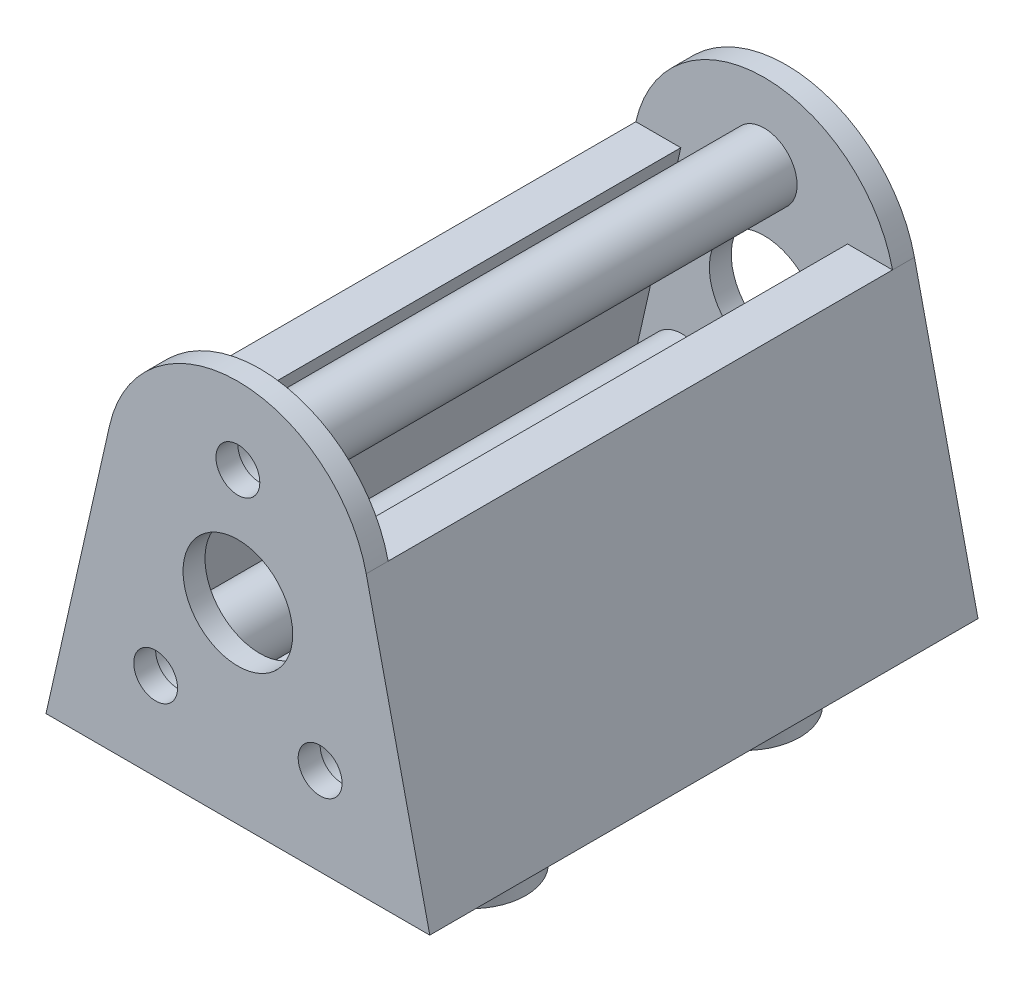
from build123d import *

# Parameters (mm, degrees)
SKETCH1_R           = 5
SKETCH1_R_2         = 2
BOSS_EXTRUDE1_DEPTH = 2
SKETCH2_R           = 2
SKETCH2_R_2         = 5
BOSS_EXTRUDE2_DEPTH = 2
SKETCH4_R           = 3
SKETCH4_R_2         = 2.5
BOSS_EXTRUDE4_DEPTH = 46
BOSS_EXTRUDE5_REACH = 63.929
SKETCH8_R           = 5
SKETCH8_R_2         = 2.5
BOSS_EXTRUDE6_DEPTH = 5


with BuildPart() as part:
    # Sketch1 → Boss-Extrude1 (new body)
    with BuildSketch(Plane.XY):
        with BuildLine():
            Line((-17.5, 0), (17.5, 0))
            Line((17.5, 0), (11.704867869, 25.645008161))
            ThreePointArc((11.704867869, 25.645008161), (0, 35), (-11.704867869, 25.645008161))
            Line((-11.704867869, 25.645008161), (-17.5, 0))
        make_face()
        with Locations((0, 17.5)):
            Circle(SKETCH1_R, mode=Mode.SUBTRACT)
        with Locations((7.5, 8)):
            Circle(SKETCH1_R_2, mode=Mode.SUBTRACT)
        with Locations((-7.5, 8)):
            Circle(SKETCH1_R_2, mode=Mode.SUBTRACT)
        with Locations((0, 28)):
            Circle(SKETCH1_R_2, mode=Mode.SUBTRACT)
    extrude(amount=BOSS_EXTRUDE1_DEPTH)



with BuildPart() as body_2:
    # Sketch2 → Boss-Extrude2 (new body)
    with BuildSketch(Plane.XY.offset(-48)):
        with BuildLine():
            Line((17.5, 0), (11.704867869, 25.645008161))
            ThreePointArc((11.704867869, 25.645008161), (0, 35), (-11.704867869, 25.645008161))
            Line((-11.704867869, 25.645008161), (-17.5, 0))
            Line((-17.5, 0), (17.5, 0))
        make_face()
        with Locations((-7.5, 8)):
            Circle(SKETCH2_R, mode=Mode.SUBTRACT)
        with Locations((7.5, 8)):
            Circle(SKETCH2_R, mode=Mode.SUBTRACT)
        with Locations((0, 17.5)):
            Circle(SKETCH2_R_2, mode=Mode.SUBTRACT)
        with Locations((0, 28)):
            Circle(SKETCH2_R, mode=Mode.SUBTRACT)
    extrude(amount=BOSS_EXTRUDE2_DEPTH)


with BuildPart() as part_1:
    add(part.part)

    add(body_2.part)  # Boss-Extrude4 merges body 2
    # Sketch4 → Boss-Extrude4 (add)
    # profile 1 of 3: a face of its own
    with BuildSketch(Plane(origin=(0, 0, 0), x_dir=(-1, 0, 0), z_dir=(0, 0, -1))):
        with Locations(Location((7.5, 8, 0), (0, 0, 180))):
            Circle(SKETCH4_R)
        with Locations(Location((7.5, 8, 0), (0, 0, 180))):
            Circle(SKETCH4_R_2, mode=Mode.SUBTRACT)
    # profile 2 of 3: a face of its own
    with BuildSketch(Plane(origin=(0, 0, 0), x_dir=(-1, 0, 0), z_dir=(0, 0, -1))):
        with Locations(Location((0, 28, 0), (0, 0, 180))):
            Circle(SKETCH4_R)
        with Locations(Location((0, 28, 0), (0, 0, 180))):
            Circle(SKETCH4_R_2, mode=Mode.SUBTRACT)
    # profile 3 of 3: a face of its own
    with BuildSketch(Plane(origin=(0, 0, 0), x_dir=(-1, 0, 0), z_dir=(0, 0, -1))):
        with Locations(Location((-7.5, 8, 0), (0, 0, 180))):
            Circle(SKETCH4_R)
        with Locations(Location((-7.5, 8, 0), (0, 0, 180))):
            Circle(SKETCH4_R_2, mode=Mode.SUBTRACT)
    extrude(amount=BOSS_EXTRUDE4_DEPTH)

    # Sketch3 → Boss-Extrude5 (add, up to next)
    with BuildSketch(Plane(origin=(0, 0, 0), x_dir=(-1, 0, 0), z_dir=(0, 0, -1)), mode=Mode.PRIVATE) as boss_extrude5_sk1:
        Polygon((12.495241869, 4), (16.59609978, 4), (11.704867869, 25.645008161), (7.604009958, 25.645008161), align=None)
    boss_extrude5_tool1 = extrude(boss_extrude5_sk1.sketch, amount=BOSS_EXTRUDE5_REACH, mode=Mode.PRIVATE) - part_1.part
    # Sketch3 → Boss-Extrude5 (add, up to next)
    with BuildSketch(Plane(origin=(0, 0, 0), x_dir=(-1, 0, 0), z_dir=(0, 0, -1)), mode=Mode.PRIVATE) as boss_extrude5_sk2:
        Polygon((-16.59609978, 4), (-12.495241869, 4), (-7.604009958, 25.645008161), (-11.704867869, 25.645008161), align=None)
    boss_extrude5_tool2 = extrude(boss_extrude5_sk2.sketch, amount=BOSS_EXTRUDE5_REACH, mode=Mode.PRIVATE) - part_1.part
    # Sketch3 → Boss-Extrude5 (add, up to next)
    with BuildSketch(Plane(origin=(0, 0, 0), x_dir=(-1, 0, 0), z_dir=(0, 0, -1)), mode=Mode.PRIVATE) as boss_extrude5_sk3:
        Polygon((17.5, 0), (16.59609978, 4), (12.495241869, 4), (-12.495241869, 4), (-16.59609978, 4), (-17.5, 0), align=None)
    boss_extrude5_tool3 = extrude(boss_extrude5_sk3.sketch, amount=BOSS_EXTRUDE5_REACH, mode=Mode.PRIVATE) - part_1.part
    add(boss_extrude5_tool1.solids().sort_by_distance((-12.100055, 14.822504, 0))[0])
    add(boss_extrude5_tool2.solids().sort_by_distance((12.100055, 14.822504, 0))[0])
    add(boss_extrude5_tool3.solids().sort_by_distance((0, 1.982326, 0))[0])

    # Sketch8 → Boss-Extrude6 (add)
    # profile 1 of 4: a face of its own
    with BuildSketch(Plane.XZ):
        with Locations(Location((8.75, -10.5, 0), (0, 0, 90))):
            Circle(SKETCH8_R)
        with Locations(Location((8.75, -10.5, 0), (0, 0, 270))):
            Circle(SKETCH8_R_2, mode=Mode.SUBTRACT)
    # profile 2 of 4: a face of its own
    with BuildSketch(Plane.XZ):
        with Locations(Location((8.75, -35.5, 0), (0, 0, 90))):
            Circle(SKETCH8_R)
        with Locations(Location((8.75, -35.5, 0), (0, 0, 90))):
            Circle(SKETCH8_R_2, mode=Mode.SUBTRACT)
    # profile 3 of 4: a face of its own
    with BuildSketch(Plane.XZ):
        with Locations(Location((-8.75, -35.5, 0), (0, 0, 90))):
            Circle(SKETCH8_R)
        with Locations(Location((-8.75, -35.5, 0), (0, 0, 270))):
            Circle(SKETCH8_R_2, mode=Mode.SUBTRACT)
    # profile 4 of 4: a face of its own
    with BuildSketch(Plane.XZ):
        with Locations(Location((-8.75, -10.5, 0), (0, 0, 90))):
            Circle(SKETCH8_R)
        with Locations(Location((-8.75, -10.5, 0), (0, 0, 90))):
            Circle(SKETCH8_R_2, mode=Mode.SUBTRACT)
    extrude(amount=BOSS_EXTRUDE6_DEPTH)


solid = part_1.part
